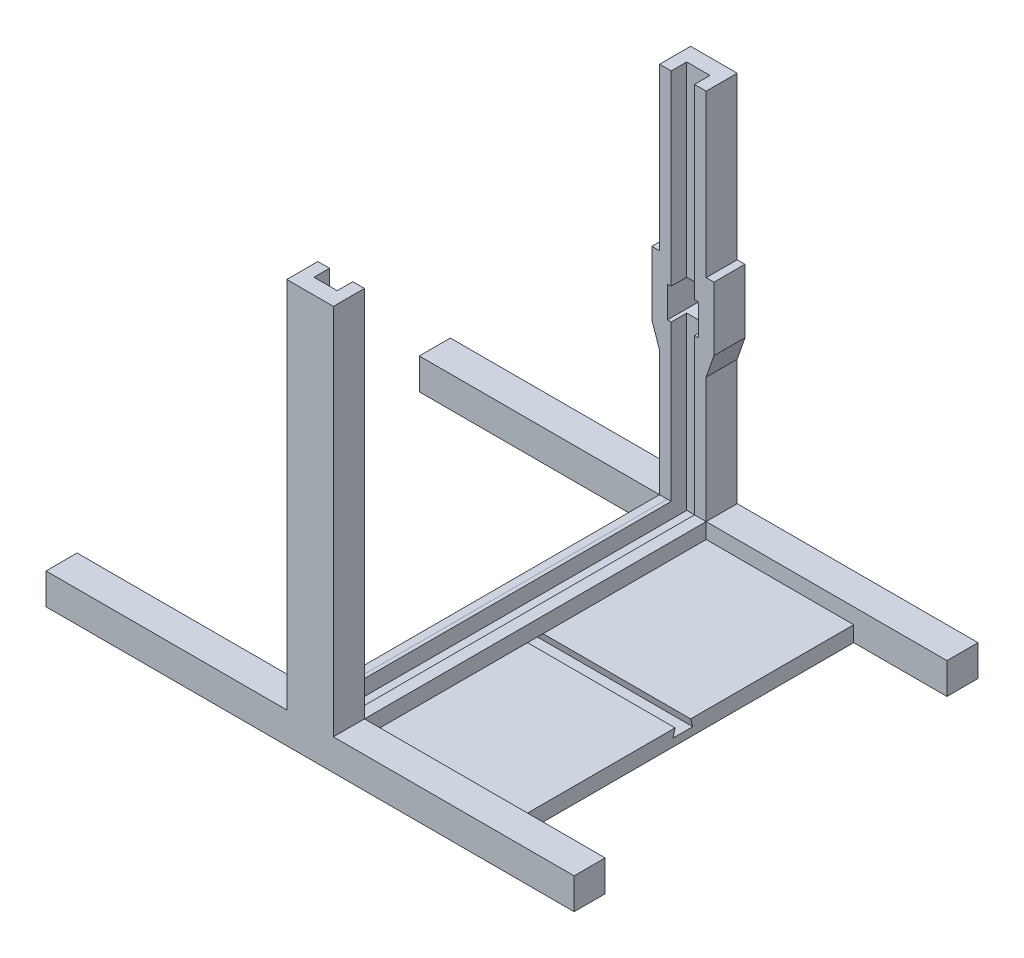
from build123d import *

# Parameters (mm, degrees)
BOSS_EXTRUDE2_DEPTH  = 6.35
BOSS_EXTRUDE3_DEPTH  = 6.35
SKETCH3_W            = 1.5875
SKETCH3_H            = 158.75
BOSS_EXTRUDE4_DEPTH  = 6.35
SKETCH4_W            = 12.7
SKETCH4_H            = 6.35
BOSS_EXTRUDE5_DEPTH  = 158.75
SKETCH5_W            = 12.7
SKETCH5_H            = 6.35
BOSS_EXTRUDE6_DEPTH  = 158.75
SKETCH6_W            = 1.5875
SKETCH6_H            = 158.75
BOSS_EXTRUDE7_DEPTH  = 6.35
SKETCH7_W            = 1.5875
SKETCH7_H            = 158.75
BOSS_EXTRUDE8_DEPTH  = 6.35
SKETCH8_W            = 1.5875
SKETCH8_H            = 6.35
BOSS_EXTRUDE9_DEPTH  = 139.7
SKETCH10_W           = 1.5875
SKETCH10_H           = 6.35
BOSS_EXTRUDE10_DEPTH = 139.7
SKETCH11_W           = 12.7
SKETCH11_H           = 12.699759929
BOSS_EXTRUDE11_DEPTH = 101.6
SKETCH12_W           = 101.404934815
SKETCH12_H           = 12.7
BOSS_EXTRUDE12_DEPTH = 6.35
SKETCH13_W           = 101.6
SKETCH13_H           = 12.7
BOSS_EXTRUDE13_DEPTH = 6.35
SKETCH14_W           = 12.7
SKETCH14_H           = 12.7
BOSS_EXTRUDE14_DEPTH = 101.6
SKETCH15_W           = 139.7
SKETCH15_H           = 6.35
BOSS_EXTRUDE15_DEPTH = 63.5
CUT_EXTRUDE1_DEPTH   = 3.175
CUT_EXTRUDE1_DRAFT   = 15
CUT_EXTRUDE3_DEPTH   = 6.35
SKETCH18_W           = 12.7
SKETCH18_H           = 152.4
BOSS_EXTRUDE17_DEPTH = 3.175
SKETCH19_W           = 12.7
SKETCH19_H           = 152.4
BOSS_EXTRUDE18_DEPTH = 3.175
SKETCH20_W           = 12.7
SKETCH20_H           = 152.4
BOSS_EXTRUDE19_DEPTH = 3.175
SKETCH21_W           = 12.7
SKETCH21_H           = 152.4
BOSS_EXTRUDE20_DEPTH = 3.175
SKETCH22_W           = 139.7
SKETCH22_H           = 6.35
BOSS_EXTRUDE21_DEPTH = 3.175
SKETCH23_W           = 139.7
SKETCH23_H           = 12.699759929
BOSS_EXTRUDE22_DEPTH = 3.175
CUT_EXTRUDE4_DEPTH   = 12.7
SKETCH30_W           = 12.7
SKETCH30_H           = 26.035
BOSS_EXTRUDE25_DEPTH = 3.175
SKETCH31_W           = 12.7
SKETCH31_H           = 26.035
BOSS_EXTRUDE26_DEPTH = 3.175
BOSS_EXTRUDE27_DEPTH = 12.7
BOSS_EXTRUDE28_DEPTH = 12.7
SKETCH37_R           = 0.635
BOSS_EXTRUDE29_DEPTH = 7.9375
CUT_EXTRUDE5_START   = -8.4455
SKETCH38_R           = 0.635
CUT_EXTRUDE5_DEPTH   = 8.4455
CUT_EXTRUDE6_START   = -8.4455
SKETCH39_R           = 0.635
CUT_EXTRUDE6_DEPTH   = 8.4455
CUT_EXTRUDE7_START   = -8.4455
SKETCH40_R           = 0.635
CUT_EXTRUDE7_DEPTH   = 8.4455
CUT_EXTRUDE8_START   = -8.4455
SKETCH41_R           = 0.635
CUT_EXTRUDE8_DEPTH   = 8.4455


with BuildPart() as part:
    # Sketch1 → Boss-Extrude2 (new body)
    with BuildSketch(Plane.XY):
        Polygon((0, 0), (215.704934815, 0), (215.704934815, 12.7), (114.104934815, 12.7), (114.104934815, 165.1), (101.404934815, 165.1), (101.404934815, 12.7), (0, 12.7), align=None)
    extrude(amount=BOSS_EXTRUDE2_DEPTH)

    # Sketch2 → Boss-Extrude3 (add)
    with BuildSketch(Plane.XY.offset(6.35)):
        Polygon((101.404934815, 12.7), (101.404934815, 6.35), (102.992434815, 6.35), (102.992434815, 165.1), (101.404934815, 165.1), align=None)
    extrude(amount=BOSS_EXTRUDE3_DEPTH)

    # Sketch3 → Boss-Extrude4 (add)
    with BuildSketch(Plane.XY.offset(6.35)):
        with Locations((113.311184815, 85.725)):
            Rectangle(SKETCH3_W, SKETCH3_H)
    extrude(amount=BOSS_EXTRUDE4_DEPTH)

    # Sketch4 → Boss-Extrude5 (add)
    with BuildSketch(Plane.XY.offset(6.35)):
        with Locations((107.754934815, 3.175)):
            Rectangle(SKETCH4_W, SKETCH4_H)
    extrude(amount=BOSS_EXTRUDE5_DEPTH)

    # Sketch5 → Boss-Extrude6 (add)
    with BuildSketch(Plane(origin=(0, 6.35, 0), x_dir=(1, 0, 0), z_dir=(0, 1, 0))):
        with Locations((107.754934815, -161.925)):
            Rectangle(SKETCH5_W, SKETCH5_H)
    extrude(amount=BOSS_EXTRUDE6_DEPTH)

    # Sketch6 → Boss-Extrude7 (add)
    with BuildSketch(Plane(origin=(0, 0, 158.75), x_dir=(-1, 0, 0), z_dir=(0, 0, -1))):
        with Locations((-102.198684815, 85.725)):
            Rectangle(SKETCH6_W, SKETCH6_H)
    extrude(amount=BOSS_EXTRUDE7_DEPTH)

    # Sketch7 → Boss-Extrude8 (add)
    with BuildSketch(Plane(origin=(0, 0, 158.75), x_dir=(-1, 0, 0), z_dir=(0, 0, -1))):
        with Locations((-113.311184815, 85.725)):
            Rectangle(SKETCH7_W, SKETCH7_H)
    extrude(amount=BOSS_EXTRUDE8_DEPTH)

    # Sketch8 → Boss-Extrude9 (add)
    with BuildSketch(Plane(origin=(0, 0, 152.4), x_dir=(-1, 0, 0), z_dir=(0, 0, -1))):
        with Locations((-113.311184815, 9.525)):
            Rectangle(SKETCH8_W, SKETCH8_H)
    extrude(amount=BOSS_EXTRUDE9_DEPTH)

    # Sketch10 → Boss-Extrude10 (add)
    with BuildSketch(Plane.XY.offset(12.7)):
        with Locations((102.198684815, 9.525)):
            Rectangle(SKETCH10_W, SKETCH10_H)
    extrude(amount=BOSS_EXTRUDE10_DEPTH)

    # Sketch11 → Boss-Extrude11 (add)
    with BuildSketch(Plane.ZY.offset(-101.404934815)):
        with Locations((158.75, 6.349879965)):
            Rectangle(SKETCH11_W, SKETCH11_H)
    extrude(amount=BOSS_EXTRUDE11_DEPTH)

    # Sketch12 → Boss-Extrude12 (add)
    with BuildSketch(Plane.XY.offset(6.35)):
        with Locations((50.702467408, 6.35)):
            Rectangle(SKETCH12_W, SKETCH12_H)
    extrude(amount=BOSS_EXTRUDE12_DEPTH)

    # Sketch13 → Boss-Extrude13 (add)
    with BuildSketch(Plane.XY.offset(6.35)):
        with Locations((164.904934815, 6.35)):
            Rectangle(SKETCH13_W, SKETCH13_H)
    extrude(amount=BOSS_EXTRUDE13_DEPTH)

    # Sketch14 → Boss-Extrude14 (add)
    with BuildSketch(Plane(origin=(114.104934815, 0, 0), x_dir=(0, 0, -1), z_dir=(1, 0, 0))):
        with Locations((-158.75, 6.35)):
            Rectangle(SKETCH14_W, SKETCH14_H)
    extrude(amount=BOSS_EXTRUDE14_DEPTH)

    # Sketch15 → Boss-Extrude15 (add)
    with BuildSketch(Plane(origin=(114.104934815, 0, 0), x_dir=(0, 0, -1), z_dir=(1, 0, 0))):
        with Locations((-82.55, 3.175)):
            Rectangle(SKETCH15_W, SKETCH15_H)
    extrude(amount=BOSS_EXTRUDE15_DEPTH)


with BuildPart() as cut_extrude1_tool:
    # Sketch16 → Cut-Extrude1 (with draft: the straight prism first)
    with BuildSketch(Plane(origin=(0, 6.35, 0), x_dir=(1, 0, 0), z_dir=(0, 1, 0))):
        Polygon((177.604934815, -82.55), (177.604934815, -79.375), (114.104934815, -79.375), (114.104934815, -82.55), (114.104934815, -85.725), (177.604934815, -85.725), align=None)
    extrude(amount=-CUT_EXTRUDE1_DEPTH)
    # Cut-Extrude1: the draft: its side faces are tilted about the plane it starts from
    cut_extrude1_sides = [cut_extrude1_tool.faces().sort_by_distance(p)[0] for p in [
        (177.604934815, 4.7625, 82.55),
        (114.104934815, 4.7625, 82.55),
        (145.854934815, 4.7625, 85.725),
        (145.854934815, 4.7625, 79.375),
    ]]
    draft(cut_extrude1_sides, Plane(origin=(0, 6.35, 0), x_dir=(1, 0, 0), z_dir=(0, 1, 0)), CUT_EXTRUDE1_DRAFT)


with BuildPart() as part_1:
    add(part.part)

    # Cut-Extrude1: cut by cut_extrude1_tool
    add(cut_extrude1_tool.part, mode=Mode.SUBTRACT)

    # Sketch17 → Cut-Extrude3 (cut)
    with BuildSketch(Plane(origin=(0, 0, 0), x_dir=(-1, 0, 0), z_dir=(0, 0, -1))):
        Polygon((-107.803701111, 87.3125), (-112.566201111, 87.3125), (-112.566201111, 82.55), (-112.566201111, 77.784684897), (-107.806516214, 77.784684897), (-103.041201111, 77.784684897), (-103.041201111, 82.55), (-103.041201111, 87.3125), align=None)
    extrude(amount=-CUT_EXTRUDE3_DEPTH, mode=Mode.SUBTRACT)

    # Sketch18 → Boss-Extrude17 (add)
    with BuildSketch(Plane.ZY.offset(-101.404934815)):
        with Locations((6.35, 88.9)):
            Rectangle(SKETCH18_W, SKETCH18_H)
    extrude(amount=BOSS_EXTRUDE17_DEPTH)

    # Sketch19 → Boss-Extrude18 (add)
    with BuildSketch(Plane(origin=(114.104934815, 0, 0), x_dir=(0, 0, -1), z_dir=(1, 0, 0))):
        with Locations((-6.35, 88.9)):
            Rectangle(SKETCH19_W, SKETCH19_H)
    extrude(amount=BOSS_EXTRUDE18_DEPTH)

    # Sketch20 → Boss-Extrude19 (add)
    with BuildSketch(Plane.ZY.offset(-101.404934815)):
        with Locations((158.75, 88.9)):
            Rectangle(SKETCH20_W, SKETCH20_H)
    extrude(amount=BOSS_EXTRUDE19_DEPTH)

    # Sketch21 → Boss-Extrude20 (add)
    with BuildSketch(Plane(origin=(114.104934815, 0, 0), x_dir=(0, 0, -1), z_dir=(1, 0, 0))):
        with Locations((-158.75, 88.9)):
            Rectangle(SKETCH21_W, SKETCH21_H)
    extrude(amount=BOSS_EXTRUDE20_DEPTH)

    # Sketch22 → Boss-Extrude21 (add)
    with BuildSketch(Plane(origin=(114.104934815, 0, 0), x_dir=(0, 0, -1), z_dir=(1, 0, 0))):
        with Locations((-82.55, 9.525)):
            Rectangle(SKETCH22_W, SKETCH22_H)
    extrude(amount=BOSS_EXTRUDE21_DEPTH)

    # Sketch23 → Boss-Extrude22 (add)
    with BuildSketch(Plane.ZY.offset(-101.404934815)):
        with Locations((82.55, 6.349879965)):
            Rectangle(SKETCH23_W, SKETCH23_H)
    extrude(amount=BOSS_EXTRUDE22_DEPTH)

    # Sketch25 → Cut-Extrude4 (cut)
    with BuildSketch(Plane(origin=(0, 0, 0), x_dir=(-1, 0, 0), z_dir=(0, 0, -1))):
        Polygon((-112.566201111, 88.9), (-101.453701111, 88.9), (-101.453701111, 76.2), (-114.153701111, 76.2), (-114.153701111, 88.9), align=None)
    extrude(amount=-CUT_EXTRUDE4_DEPTH, mode=Mode.SUBTRACT)

    # Sketch30 → Boss-Extrude25 (add)
    with BuildSketch(Plane(origin=(117.279934815, 0, 0), x_dir=(0, 0, -1), z_dir=(1, 0, 0))):
        with Locations((-6.35, 86.0425)):
            Rectangle(SKETCH30_W, SKETCH30_H)
    extrude(amount=BOSS_EXTRUDE25_DEPTH)

    # Sketch31 → Boss-Extrude26 (add)
    with BuildSketch(Plane.ZY.offset(-98.229934815)):
        with Locations((6.35, 86.0425)):
            Rectangle(SKETCH31_W, SKETCH31_H)
    extrude(amount=BOSS_EXTRUDE26_DEPTH)

    # Sketch32 → Boss-Extrude27 (add)
    with BuildSketch(Plane(origin=(0, 0, 0), x_dir=(-1, 0, 0), z_dir=(0, 0, -1))):
        Polygon((-120.454934815, 73.025), (-117.279934815, 63.840058945), (-117.279934815, 73.025), align=None)
    extrude(amount=-BOSS_EXTRUDE27_DEPTH)

    # Sketch36 → Boss-Extrude28 (add)
    with BuildSketch(Plane(origin=(0, 0, 0), x_dir=(-1, 0, 0), z_dir=(0, 0, -1))):
        Polygon((-95.054934815, 73.025), (-98.229934815, 63.911198594), (-98.229934815, 73.025), align=None)
    extrude(amount=-BOSS_EXTRUDE28_DEPTH)

    # Sketch37 → Boss-Extrude29 (add)
    with BuildSketch(Plane(origin=(0, 0, 0), x_dir=(-1, 0, 0), z_dir=(0, 0, -1))):
        with Locations(Location((-117.803681111, 82.55, 0), (0, 0, 180))):
            Circle(SKETCH37_R)
        with Locations(Location((-96.803672311, 82.55, 0), (0, 0, 180))):
            Circle(SKETCH37_R)
        with Locations(Location((-96.803672311, 94.5500014, 0), (0, 0, 180))):
            Circle(SKETCH37_R)
        with Locations(Location((-117.803681111, 94.5500014, 0), (0, 0, 180))):
            Circle(SKETCH37_R)
    extrude(amount=BOSS_EXTRUDE29_DEPTH)

    # Sketch38 → Cut-Extrude5 (cut)
    with BuildSketch(Plane(origin=(0, 0, -7.9375), x_dir=(-1, 0, 0), z_dir=(0, 0, -1)).offset(CUT_EXTRUDE5_START)):
        with Locations((-117.803681111, 94.5500014)):
            Circle(SKETCH38_R)
    extrude(amount=CUT_EXTRUDE5_DEPTH, mode=Mode.SUBTRACT)

    # Sketch39 → Cut-Extrude6 (cut)
    with BuildSketch(Plane(origin=(0, 0, -7.9375), x_dir=(-1, 0, 0), z_dir=(0, 0, -1)).offset(CUT_EXTRUDE6_START)):
        with Locations((-96.803672311, 94.5500014)):
            Circle(SKETCH39_R)
    extrude(amount=CUT_EXTRUDE6_DEPTH, mode=Mode.SUBTRACT)

    # Sketch40 → Cut-Extrude7 (cut)
    with BuildSketch(Plane(origin=(0, 0, -7.9375), x_dir=(-1, 0, 0), z_dir=(0, 0, -1)).offset(CUT_EXTRUDE7_START)):
        with Locations((-117.803681111, 82.55)):
            Circle(SKETCH40_R)
    extrude(amount=CUT_EXTRUDE7_DEPTH, mode=Mode.SUBTRACT)

    # Sketch41 → Cut-Extrude8 (cut)
    with BuildSketch(Plane(origin=(0, 0, -7.9375), x_dir=(-1, 0, 0), z_dir=(0, 0, -1)).offset(CUT_EXTRUDE8_START)):
        with Locations((-96.803672311, 82.55)):
            Circle(SKETCH41_R)
    extrude(amount=CUT_EXTRUDE8_DEPTH, mode=Mode.SUBTRACT)


solid = part_1.part
